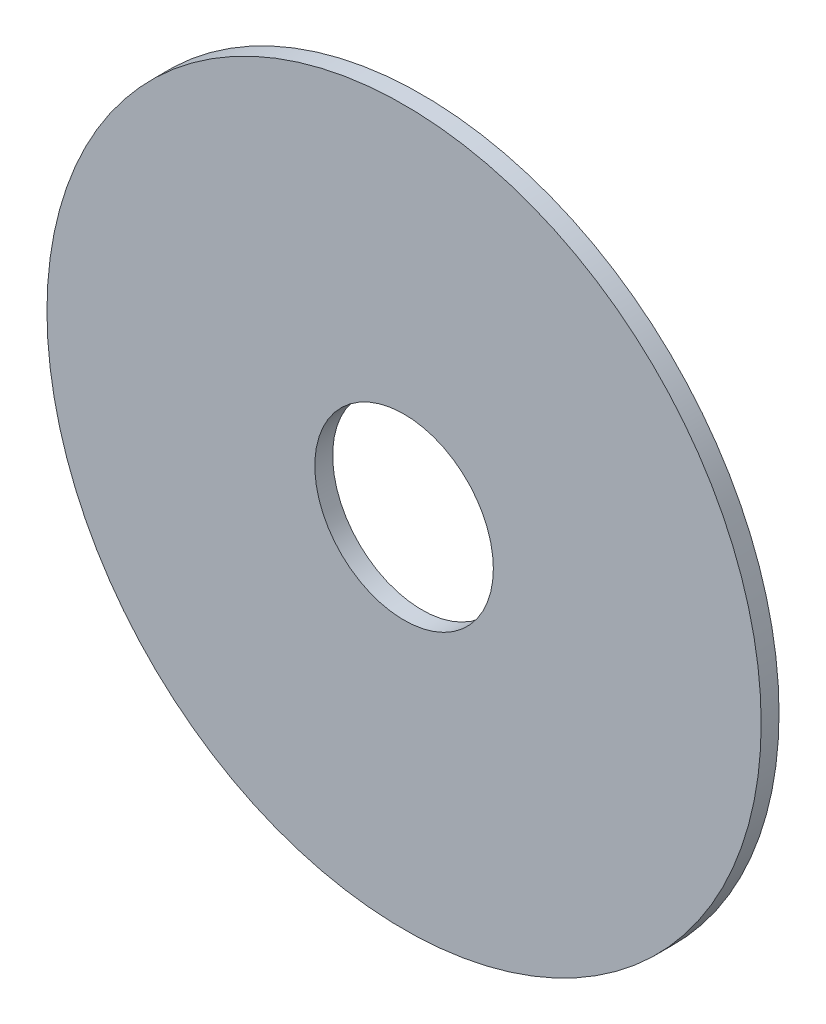
from build123d import *

# Parameters (mm, degrees)
SKETCH_1_R      = 100
SKETCH_1_R_2    = 25
EXTRUDE_1_DEPTH = 5


with BuildPart() as part:
    # 草图1 → 凸台-拉伸1 (new body)
    with BuildSketch(Plane.XY):
        Circle(SKETCH_1_R)
        Circle(SKETCH_1_R_2, mode=Mode.SUBTRACT)
    extrude(amount=EXTRUDE_1_DEPTH)


solid = part.part
